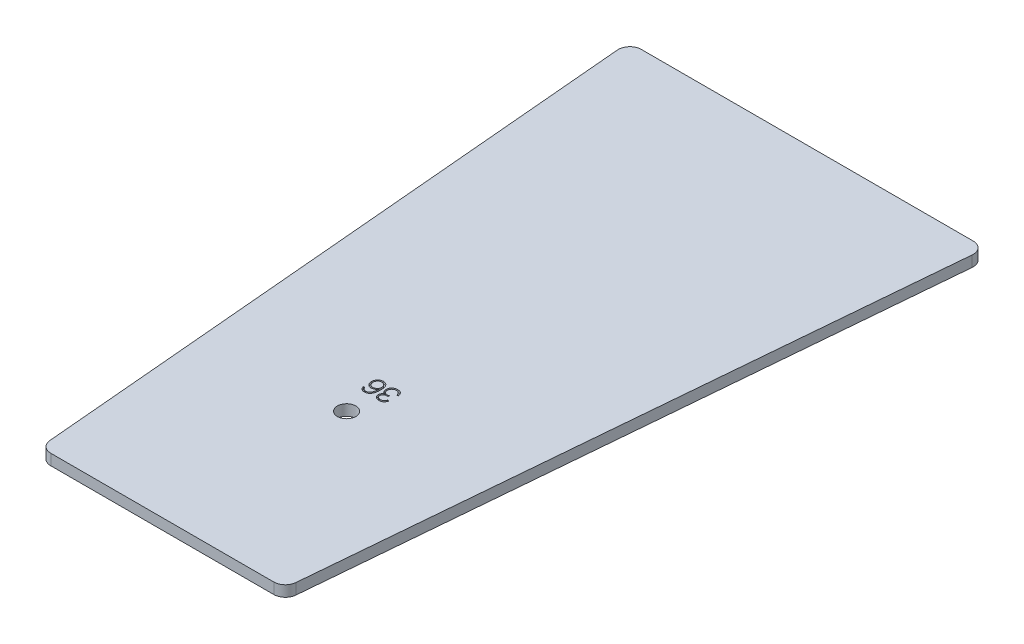
from build123d import *

# Parameters (mm, degrees)
BOSS_EXTRUDE1_DEPTH   = 5.9944
SKETCH2_R             = 5.08
CUT_EXTRUDE1_DEPTH    = 370.01758755
CUT_EXTRUDE2_DEPTH    = 1.27
FILLET1_R             = 6.35
BODY_MOVE_COPY1_ANGLE = 180


with BuildPart() as part:
    # Sketch1 → Boss-Extrude1 (new body)
    with BuildSketch(Plane(origin=(0, 0, 0), x_dir=(1, 0, 0), z_dir=(0, 1, 0))):
        Polygon((-67.31, 0), (67.31, 0), (98.42096875, -355.6), (-98.42096875, -355.6), align=None)
    extrude(amount=BOSS_EXTRUDE1_DEPTH)

    # Sketch2 → Cut-Extrude1 (cut, through all)
    with BuildSketch(Plane(origin=(0, 5.9944, 0), x_dir=(1, 0, 0), z_dir=(0, 1, 0))):
        with Locations(Location((0, -101.6, 0), (0, 0, 270))):
            Circle(SKETCH2_R)
    extrude(amount=-CUT_EXTRUDE1_DEPTH, mode=Mode.SUBTRACT)

    # Sketch3 → Cut-Extrude2 (cut)
    # profile 1 of 2: a face of its own
    with BuildSketch(Plane(origin=(0, 5.9944, 0), x_dir=(1, 0, 0), z_dir=(0, 1, 0))):
        with BuildLine():
            Line((-7.022352941, -123.169876974), (-6.225490196, -123.042254425))
            add(Edge.make_bspline(
                [(-6.225490196, -123.042254425), (-6.179159168, -123.214946895), (-6.090766085, -123.544419824), (-5.893002314, -123.994390528), (-5.653326656, -124.378911196), (-5.362735748, -124.693991158), (-5.023623342, -124.938121569), (-4.639439373, -125.110833155), (-4.210900555, -125.216270361), (-3.91023845, -125.227691096), (-3.753970588, -125.233626974)],
                knots=[0, 0, 0, 0, 1.185952709, 2.262630877, 3.250838064, 4.182033203, 5.090336224, 6.006134824, 6.963696984, 8, 8, 8, 8], degree=3))
            add(Edge.make_bspline(
                [(-3.753970588, -125.233626974), (-3.632311974, -125.230568589), (-3.396778139, -125.224647487), (-3.055537122, -125.163712532), (-2.739613531, -125.064134055), (-2.44676451, -124.92670666), (-2.1842903, -124.751585639), (-1.946018921, -124.550720514), (-1.740349543, -124.317891486), (-1.561552955, -124.058854655), (-1.416849481, -123.772763913), (-1.319432673, -123.460118889), (-1.253270796, -123.1280476), (-1.247865406, -122.898370363), (-1.245098039, -122.780783837)],
                knots=[0, 0, 0, 0, 1.112391676, 2.1536155, 3.159607968, 4.13650094, 5.103002125, 6.039177095, 6.980681787, 7.936725385, 8.913387604, 9.901293339, 10.925537295, 12, 12, 12, 12], degree=3))
            add(Edge.make_bspline(
                [(-1.245098039, -122.780783837), (-1.246477833, -122.701796706), (-1.249194291, -122.546291405), (-1.282695151, -122.320700987), (-1.327451026, -122.106212724), (-1.396057418, -121.90521732), (-1.489048405, -121.718651135), (-1.592290807, -121.53903737), (-1.722685616, -121.377037067), (-1.917485463, -121.177617519), (-2.20188298, -120.965343344), (-2.593312238, -120.778287214), (-3.036743624, -120.672529645), (-3.346678027, -120.658810089), (-3.508063725, -120.65166619)],
                knots=[0, 0, 0, 0, 0.811772018, 1.598169866, 2.341374635, 3.06367051, 3.774921333, 4.483283491, 5.190035732, 5.907028974, 7.347870326, 8.813481259, 10.340750343, 12, 12, 12, 12], degree=3))
            add(Edge.make_bspline(
                [(-3.508063725, -120.65166619), (-3.570458136, -120.654485201), (-3.706544321, -120.660633643), (-3.923959231, -120.701406965), (-4.170366976, -120.763689637), (-4.34159116, -120.820632591), (-4.43254902, -120.850881876)],
                knots=[0, 0, 0, 0, 0.788647944, 1.720091416, 2.788864984, 4, 4, 4, 4], degree=3))
            Line((-4.43254902, -120.850881876), (-4.339166667, -120.054019131))
            add(Edge.make_bspline(
                [(-4.339166667, -120.054019131), (-4.211491436, -120.052210279), (-3.969367573, -120.048779964), (-3.628545312, -120.02409108), (-3.330265399, -119.986538227), (-3.000954361, -119.908899184), (-2.646422183, -119.776207787), (-2.338322284, -119.59215919), (-2.131152352, -119.420635409), (-1.999871604, -119.280008589), (-1.890363345, -119.128785942), (-1.797899612, -118.969165263), (-1.729210893, -118.794754545), (-1.681209143, -118.609619246), (-1.647346728, -118.41274206), (-1.644829413, -118.277832032), (-1.643529412, -118.208161288)],
                knots=[0, 0, 0, 0, 1.451240035, 2.752137916, 3.88312397, 4.8644669, 6.592895175, 8.164668079, 8.918269139, 9.644320432, 10.345018353, 11.037025267, 11.735734825, 12.468177286, 13.208930344, 14, 14, 14, 14], degree=3))
            add(Edge.make_bspline(
                [(-1.643529412, -118.208161288), (-1.650509345, -118.084884612), (-1.66411437, -117.84459831), (-1.776821399, -117.502320159), (-1.96596106, -117.199539256), (-2.224892561, -116.941975312), (-2.536214171, -116.730294037), (-2.893116827, -116.576750655), (-3.290761262, -116.484669627), (-3.568768596, -116.473797191), (-3.713504902, -116.468136778)],
                knots=[0, 0, 0, 0, 0.976737165, 1.903819668, 2.824737209, 3.785549291, 4.781400884, 5.79567262, 6.852382064, 8, 8, 8, 8], degree=3))
            add(Edge.make_bspline(
                [(-3.713504902, -116.468136778), (-3.854039415, -116.47306545), (-4.12537475, -116.482581424), (-4.513600015, -116.568384211), (-4.865095935, -116.708788142), (-5.17833718, -116.908489139), (-5.453425475, -117.164269719), (-5.684159559, -117.480030998), (-5.883219335, -117.847102807), (-5.97729652, -118.119344734), (-6.02627451, -118.261077955)],
                knots=[0, 0, 0, 0, 1.063244, 2.052845668, 2.994088376, 3.916241797, 4.850371738, 5.821675903, 6.865931876, 8, 8, 8, 8], degree=3))
            Line((-6.02627451, -118.261077955), (-6.823137255, -118.108553445))
            add(Edge.make_bspline(
                [(-6.823137255, -118.108553445), (-6.795507069, -118.009537835), (-6.741395917, -117.815624962), (-6.638235475, -117.539274361), (-6.521644051, -117.282017007), (-6.39619017, -117.041727178), (-6.251608562, -116.822289223), (-6.09249965, -116.622939161), (-5.920815848, -116.441568961), (-5.736152715, -116.278010132), (-5.535865927, -116.134162047), (-5.320569348, -116.010252238), (-5.093111316, -115.903325727), (-4.850790057, -115.819193742), (-4.594226042, -115.755030725), (-4.324277726, -115.70398026), (-4.039873378, -115.67665496), (-3.846367498, -115.673090632), (-3.747745098, -115.671274033)],
                knots=[0, 0, 0, 0, 1.151946065, 2.255979367, 3.302323512, 4.316963809, 5.291200695, 6.243031876, 7.172717729, 8.087440795, 9.004158252, 9.931804679, 10.868449138, 11.817504777, 12.802032331, 13.83090576, 14.894497265, 16, 16, 16, 16], degree=3))
            add(Edge.make_bspline(
                [(-3.747745098, -115.671274033), (-3.640762164, -115.672408611), (-3.431393848, -115.674629008), (-3.126775673, -115.711153157), (-2.837313267, -115.763425336), (-2.56322677, -115.836268421), (-2.307835885, -115.937294862), (-2.068092886, -116.056759375), (-1.843673392, -116.195744973), (-1.638127063, -116.358813915), (-1.451493202, -116.538239913), (-1.287791849, -116.734511377), (-1.153981272, -116.94954593), (-1.040592711, -117.1772257), (-0.953424076, -117.421821454), (-0.891547543, -117.68166617), (-0.853370675, -117.956972072), (-0.848936049, -118.145780417), (-0.846666667, -118.242401484)],
                knots=[0, 0, 0, 0, 1.17304118, 2.295671334, 3.360722231, 4.399095647, 5.401139445, 6.368437906, 7.334999225, 8.291519651, 9.241514563, 10.171449278, 11.087342197, 12.013926289, 12.957350552, 13.929260155, 14.940316477, 16, 16, 16, 16], degree=3))
            add(Edge.make_bspline(
                [(-0.846666667, -118.242401484), (-0.850930579, -118.357832101), (-0.859217004, -118.58215826), (-0.92146644, -118.908210953), (-1.031917246, -119.20861272), (-1.182879951, -119.487523831), (-1.379156133, -119.740666283), (-1.614751692, -119.974570713), (-1.897947491, -120.179770174), (-2.108008459, -120.29397906), (-2.21627451, -120.35284266)],
                knots=[0, 0, 0, 0, 1.039153621, 2.01947583, 2.9741737, 3.910731788, 4.863782364, 5.848192228, 6.890951849, 8, 8, 8, 8], degree=3))
            add(Edge.make_bspline(
                [(-2.21627451, -120.35284266), (-2.076605097, -120.398409436), (-1.806544353, -120.486516038), (-1.440808729, -120.683895443), (-1.133728819, -120.931344008), (-0.877589438, -121.221910714), (-0.685343201, -121.564653309), (-0.543367347, -121.948635219), (-0.463326152, -122.380122245), (-0.453422318, -122.681882427), (-0.448235294, -122.839925994)],
                knots=[0, 0, 0, 0, 1.062050142, 2.053549488, 2.988468085, 3.904211674, 4.839582746, 5.816291321, 6.856306669, 8, 8, 8, 8], degree=3))
            add(Edge.make_bspline(
                [(-0.448235294, -122.839925994), (-0.451291104, -122.956288547), (-0.457288258, -123.184654866), (-0.502478751, -123.518931999), (-0.571377301, -123.836946619), (-0.676738803, -124.135460208), (-0.807153117, -124.418150682), (-0.969873616, -124.682845541), (-1.160792719, -124.930189538), (-1.379109975, -125.157415292), (-1.620394131, -125.361481281), (-1.881430984, -125.540156779), (-2.157648032, -125.693963795), (-2.454217209, -125.81466164), (-2.766248092, -125.912681608), (-3.097158213, -125.978561699), (-3.444464768, -126.025624632), (-3.682208492, -126.028843704), (-3.80377451, -126.030489719)],
                knots=[0, 0, 0, 0, 1.072071369, 2.103984363, 3.103853144, 4.0655425, 5.015271866, 5.96812527, 6.922560812, 7.8897021, 8.866767387, 9.829597087, 10.801124953, 11.774298562, 12.775446883, 13.810677578, 14.880528982, 16, 16, 16, 16], degree=3))
            add(Edge.make_bspline(
                [(-3.80377451, -126.030489719), (-3.91174159, -126.027654987), (-4.121899618, -126.022137178), (-4.430362418, -125.991994086), (-4.721742092, -125.935678687), (-4.998637664, -125.858776174), (-5.256115535, -125.754989716), (-5.499932286, -125.632913053), (-5.726545074, -125.487034526), (-5.936578214, -125.317213724), (-6.130179855, -125.126208159), (-6.30864799, -124.914448517), (-6.467563012, -124.67722961), (-6.614344715, -124.420168032), (-6.741149501, -124.137991678), (-6.852809332, -123.83522431), (-6.950758779, -123.511306522), (-6.998114815, -123.285467577), (-7.022352941, -123.169876974)],
                knots=[0, 0, 0, 0, 1.092142754, 2.125856941, 3.130178579, 4.090157876, 5.027443808, 5.933183123, 6.844256067, 7.747255784, 8.659958934, 9.591056537, 10.542798976, 11.543715938, 12.581523217, 13.667244669, 14.806031458, 16, 16, 16, 16], degree=3))
        make_face()
    # profile 2 of 2: a face of its own
    with BuildSketch(Plane(origin=(0, 5.9944, 0), x_dir=(1, 0, 0), z_dir=(0, 1, 0))):
        with BuildLine():
            Line((7.121960784, -117.97159266), (6.325098039, -118.061862268))
            add(Edge.make_bspline(
                [(6.325098039, -118.061862268), (6.28403775, -117.935925707), (6.205231057, -117.694216647), (6.034603733, -117.367785821), (5.835134623, -117.087787074), (5.5982806, -116.860482832), (5.328781249, -116.68181376), (5.025209569, -116.557670872), (4.689516636, -116.480780902), (4.454774389, -116.47245697), (4.332941176, -116.468136778)],
                knots=[0, 0, 0, 0, 1.146870431, 2.201179479, 3.180166395, 4.115558704, 5.031361307, 5.967056451, 6.944885096, 8, 8, 8, 8], degree=3))
            add(Edge.make_bspline(
                [(4.332941176, -116.468136778), (4.189071292, -116.474277233), (3.907829091, -116.486280822), (3.50423884, -116.593233889), (3.133875393, -116.761620528), (2.807168006, -116.998391952), (2.523231645, -117.282647799), (2.288979773, -117.604172952), (2.099058782, -117.94190018), (1.966191577, -118.233604943), (1.876994216, -118.484750145), (1.820827386, -118.70751079), (1.760430986, -118.963363623), (1.704342219, -119.258120937), (1.654535489, -119.597680937), (1.612864385, -119.988277231), (1.570514176, -120.433196433), (1.553122698, -120.749111573), (1.543921569, -120.916249523)],
                knots=[0, 0, 0, 0, 1.173866075, 2.29471706, 3.387373374, 4.48150925, 5.572749886, 6.658143751, 7.721452694, 8.734800786, 9.27382536, 9.897045428, 10.610775617, 11.422319253, 12.348087472, 13.414637189, 14.632188877, 16, 16, 16, 16], degree=3))
            add(Edge.make_bspline(
                [(1.543921569, -120.916249523), (1.637023349, -120.800032192), (1.818273438, -120.573780864), (2.123952706, -120.276140853), (2.444814371, -120.021096109), (2.785381403, -119.815382941), (3.141659605, -119.654080153), (3.514605419, -119.538284263), (3.905900627, -119.467857079), (4.17286226, -119.460232702), (4.308039216, -119.456372072)],
                knots=[0, 0, 0, 0, 1.099560593, 2.140619156, 3.145351809, 4.122405128, 5.073014963, 6.028559858, 7.00175439, 8, 8, 8, 8], degree=3))
            add(Edge.make_bspline(
                [(4.308039216, -119.456372072), (4.416137436, -119.458029746), (4.628083879, -119.461279922), (4.938078524, -119.508567989), (5.233978141, -119.574176066), (5.514200273, -119.672823655), (5.779884145, -119.796773909), (6.029033445, -119.951039237), (6.266090009, -120.128738741), (6.480314583, -120.338140207), (6.680188217, -120.562711139), (6.852356223, -120.807083619), (6.996015256, -121.067562437), (7.114492654, -121.342853539), (7.209057666, -121.633269798), (7.272663865, -121.940239947), (7.315331963, -122.261829271), (7.319202383, -122.481815997), (7.321176471, -122.594019131)],
                knots=[0, 0, 0, 0, 1.062157194, 2.082554528, 3.077735109, 4.039546362, 4.998266448, 5.955682005, 6.917060009, 7.905941251, 8.8967165, 9.870740864, 10.839188911, 11.817427888, 12.814699406, 13.837543495, 14.897049833, 16, 16, 16, 16], degree=3))
            add(Edge.make_bspline(
                [(7.321176471, -122.594019131), (7.316834339, -122.75827398), (7.308345487, -123.079391653), (7.229339797, -123.544948807), (7.098350606, -123.980536735), (6.913755068, -124.380723069), (6.689433046, -124.746773729), (6.427451448, -125.074109202), (6.123795506, -125.355132507), (5.791566432, -125.601032177), (5.422341825, -125.794755866), (5.021621171, -125.932775327), (4.59047882, -126.014736227), (4.292836322, -126.025143816), (4.13995098, -126.030489719)],
                knots=[0, 0, 0, 0, 1.126745524, 2.202783688, 3.230156191, 4.240451509, 5.218889345, 6.171026135, 7.108235364, 8.051298752, 9.000661182, 9.957925236, 10.95107957, 12, 12, 12, 12], degree=3))
            add(Edge.make_bspline(
                [(4.13995098, -126.030489719), (4.001747149, -126.026021669), (3.733367976, -126.017345126), (3.342259176, -125.958107723), (2.977181195, -125.855891294), (2.637463208, -125.711042903), (2.3224304, -125.527438928), (2.038931859, -125.296169184), (1.777405828, -125.030694909), (1.548716095, -124.723109807), (1.345309934, -124.384990682), (1.181076836, -124.014675977), (1.033501605, -123.624662842), (0.926445964, -123.202454129), (0.846383286, -122.745469869), (0.787461917, -122.24669873), (0.754489039, -121.70214559), (0.749596859, -121.324063229), (0.747058824, -121.12791619)],
                knots=[0, 0, 0, 0, 0.980578725, 1.904194015, 2.799224797, 3.663505368, 4.518357886, 5.377290719, 6.251982806, 7.156112664, 8.090493642, 9.045928726, 10.02659037, 11.046274743, 12.130875779, 13.317165725, 14.608160405, 16, 16, 16, 16], degree=3))
            add(Edge.make_bspline(
                [(0.747058824, -121.12791619), (0.748084362, -120.981587245), (0.75009267, -120.695031921), (0.770771877, -120.274794756), (0.795524954, -119.87363434), (0.841599481, -119.493054721), (0.892434473, -119.132320901), (0.958225368, -118.791674232), (1.035583835, -118.470513254), (1.153633708, -118.075139682), (1.330700949, -117.616962951), (1.60906781, -117.124395358), (1.943408745, -116.694190954), (2.266418265, -116.387309609), (2.550533831, -116.179101009), (2.773671089, -116.039952723), (3.013957915, -115.930166501), (3.260735871, -115.830964794), (3.521506934, -115.761642436), (3.791481591, -115.706969893), (4.073852307, -115.67596112), (4.266464994, -115.672850363), (4.364068627, -115.671274033)],
                knots=[0, 0, 0, 0, 1.187224864, 2.324937192, 3.413652414, 4.447534134, 5.434591873, 6.369159618, 7.261514071, 8.113891848, 9.716393032, 11.235817323, 12.687535276, 14.122877132, 14.833488484, 15.54390031, 16.251913441, 16.974248334, 17.699374539, 18.437435309, 19.208193424, 20, 20, 20, 20], degree=3))
            add(Edge.make_bspline(
                [(4.364068627, -115.671274033), (4.54306823, -115.678318246), (4.885796442, -115.691805711), (5.374430808, -115.797632833), (5.808585574, -115.979940864), (6.189465662, -116.235712407), (6.512684481, -116.566758119), (6.775054394, -116.97099718), (6.986007285, -117.443900652), (7.075277893, -117.790396967), (7.121960784, -117.97159266)],
                knots=[0, 0, 0, 0, 1.089548448, 2.086144253, 3.026265445, 3.941157169, 4.86168387, 5.823888075, 6.862030876, 8, 8, 8, 8], degree=3))
        make_face()
        with BuildLine():
            add(Edge.make_bspline(
                [(6.524313725, -122.653161288), (6.522949951, -122.565890586), (6.520294169, -122.395941636), (6.48703928, -122.147263726), (6.438142239, -121.910759219), (6.370141801, -121.686398128), (6.281821688, -121.474546031), (6.173591324, -121.276083163), (6.043479608, -121.089943108), (5.89629783, -120.916855239), (5.730344547, -120.76314107), (5.557052205, -120.621666959), (5.363663214, -120.513296847), (5.164897266, -120.411841831), (4.947670647, -120.343309451), (4.720113733, -120.289162521), (4.479078412, -120.257709231), (4.314352625, -120.254747494), (4.230220588, -120.253234817)],
                knots=[0, 0, 0, 0, 1.120515954, 2.182066891, 3.217429859, 4.221067364, 5.18910189, 6.161532432, 7.119323894, 8.102568135, 9.073901538, 10.023306689, 10.967550207, 11.915550427, 12.885144154, 13.884345082, 14.919450551, 16, 16, 16, 16], degree=3))
            add(Edge.make_bspline(
                [(4.230220588, -120.253234817), (4.142973904, -120.254729492), (3.972041853, -120.257657831), (3.720789474, -120.28954275), (3.481722758, -120.343178849), (3.251584518, -120.412495626), (3.037653698, -120.512879943), (2.82836869, -120.623124433), (2.634181163, -120.761614911), (2.450394508, -120.915325085), (2.287200697, -121.08752788), (2.137972771, -121.266704145), (2.018347986, -121.461096645), (1.916024478, -121.662317289), (1.838514806, -121.875611303), (1.782180837, -122.098693096), (1.75152021, -122.332748026), (1.745973085, -122.491216718), (1.743137255, -122.572229915)],
                knots=[0, 0, 0, 0, 1.102028161, 2.159072701, 3.192933261, 4.196419204, 5.188188219, 6.173872171, 7.181375664, 8.195341939, 9.19677015, 10.175541235, 11.135873393, 12.074021896, 13.023915352, 13.996961808, 14.975996298, 16, 16, 16, 16], degree=3))
            add(Edge.make_bspline(
                [(1.743137255, -122.572229915), (1.744259017, -122.660573936), (1.746471965, -122.834853858), (1.784190727, -123.090481679), (1.834135853, -123.338569709), (1.915219595, -123.575668435), (2.010113899, -123.80698635), (2.129515244, -124.028750507), (2.270102638, -124.241360306), (2.431446156, -124.441552435), (2.606619459, -124.629025082), (2.799214937, -124.79064599), (3.004277206, -124.924707091), (3.217479445, -125.039861264), (3.444978387, -125.125725117), (3.68377157, -125.188603721), (3.93431577, -125.226815685), (4.105576417, -125.231327374), (4.192867647, -125.233626974)],
                knots=[0, 0, 0, 0, 1.051282294, 2.073908279, 3.072727033, 4.061630754, 5.053311434, 6.048682673, 7.056561366, 8.085442914, 9.10836765, 10.108562083, 11.071875239, 12.022898087, 12.98929892, 13.960666806, 14.960555696, 16, 16, 16, 16], degree=3))
            add(Edge.make_bspline(
                [(4.192867647, -125.233626974), (4.276999969, -125.230959297), (4.442850689, -125.225700484), (4.685441664, -125.192519803), (4.915203523, -125.131162514), (5.133978256, -125.052598081), (5.337794645, -124.943296347), (5.532599271, -124.816520566), (5.712835468, -124.662297115), (5.880736761, -124.488279651), (6.031569308, -124.297198715), (6.163436861, -124.092683105), (6.276002302, -123.878434787), (6.365546286, -123.652555862), (6.439117303, -123.417854254), (6.486739685, -123.171360653), (6.520091948, -122.915543985), (6.522892849, -122.741468515), (6.524313725, -122.653161288)],
                knots=[0, 0, 0, 0, 1.038099588, 2.046414037, 3.011978406, 3.967821222, 4.906801766, 5.858263309, 6.830170406, 7.825975991, 8.837535225, 9.828144191, 10.824361045, 11.817942835, 12.822104977, 13.853871734, 14.91128464, 16, 16, 16, 16], degree=3))
        make_face(mode=Mode.SUBTRACT)
    extrude(amount=-CUT_EXTRUDE2_DEPTH, mode=Mode.SUBTRACT)

    # Fillet1
    fillet1_edges = [part.edges().sort_by_distance(p)[0] for p in [
        (98.42096875, 2.9972, 355.6),
        (-98.42096875, 2.9972, 355.6),
        (-67.31, 2.9972, 0),
        (67.31, 2.9972, 0),
    ]]
    fillet(fillet1_edges, radius=FILLET1_R)


with BuildPart() as part_1:
    # Body-Move/Copy1: moved
    add(part.part.rotate(Axis((0, 0, 177.8), (0, 1, 0)), BODY_MOVE_COPY1_ANGLE))


solid = part_1.part
